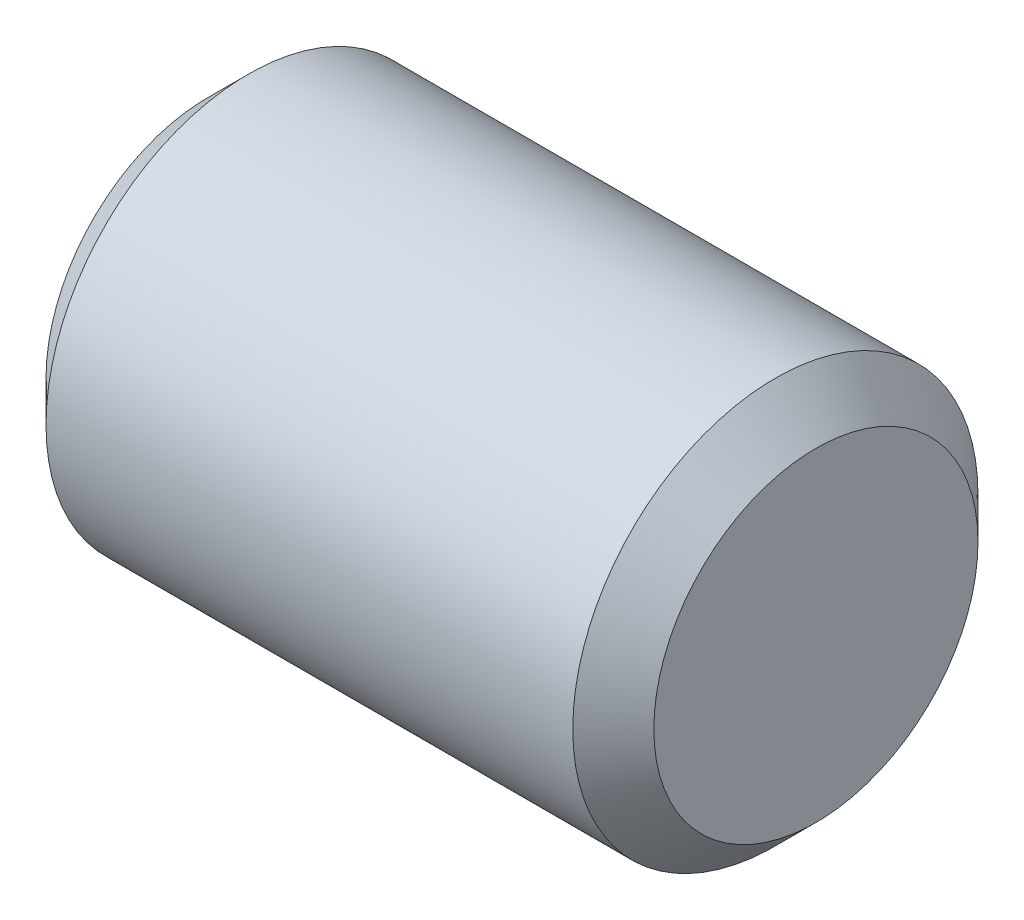
from build123d import *

# Parameters (mm, degrees)
EXTRUDE1_DEPTH      = 4.7625
EXTRUDE1_DEPTH_BACK = 4.7625
SKETCH2_R           = 3.175
CHAMFER1_SIZE       = 0.635


with BuildPart() as part:
    # Sketch2 → Extrude1 (new, two sides: drawn at the far end of the back side and taken through both)
    with BuildSketch(Plane(origin=(0, 0, 0), x_dir=(0, 0, -1), z_dir=(1, 0, 0)).offset(-EXTRUDE1_DEPTH_BACK)):
        Circle(SKETCH2_R)
    extrude(amount=EXTRUDE1_DEPTH + EXTRUDE1_DEPTH_BACK)

    # Chamfer1
    chamfer1_edges = [part.edges().sort_by_distance(p)[0] for p in [
        (-4.7625, 0, 3.175),
        (4.7625, 0, 3.175),
    ]]
    chamfer(chamfer1_edges, length=CHAMFER1_SIZE)


solid = part.part
